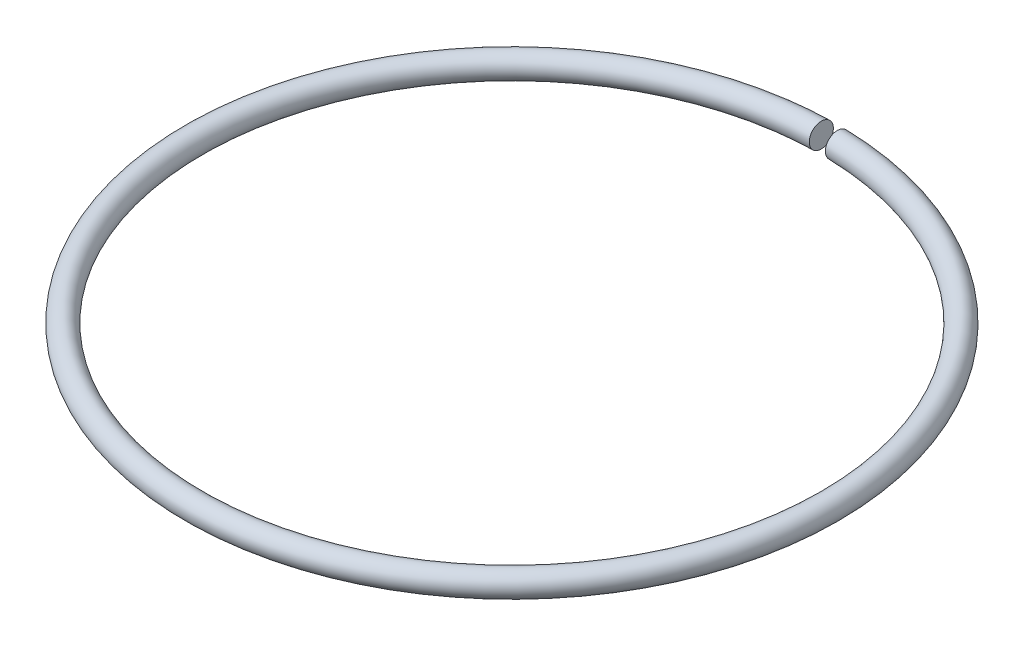
from build123d import *

# Parameters (mm, degrees)
ESBO_O1_R                  = 1.5
CORTE_EXTRUS_O1_DEPTH      = 59.002155276
CORTE_EXTRUS_O1_DEPTH_BACK = 59.002155276
ESBO_O2_W                  = 2
ESBO_O2_H                  = 6.558827033


with BuildPart() as part:
    # Esboço1 → Revolução1 (revolve)
    with BuildSketch(Plane.XY, mode=Mode.PRIVATE) as revolu_o1_sk:
        with Locations((39.5, 0)):
            Circle(ESBO_O1_R)
    revolve(revolu_o1_sk.sketch.rotate(Axis((0, 0, 0), (0, 1, 0)), 90), axis=Axis((0, 0, 0), (0, 1, 0)))

    # Esboço2 → Corte-extrusão1 (cut, two sides: drawn at the far end of the back side and taken through both)
    with BuildSketch(Plane(origin=(0, 0, 0), x_dir=(1, 0, 0), z_dir=(0, 1, 0)).offset(-CORTE_EXTRUS_O1_DEPTH_BACK)):
        with Locations((0, 39.529691088)):
            Rectangle(ESBO_O2_W, ESBO_O2_H)
    extrude(amount=CORTE_EXTRUS_O1_DEPTH + CORTE_EXTRUS_O1_DEPTH_BACK, mode=Mode.SUBTRACT)


solid = part.part
